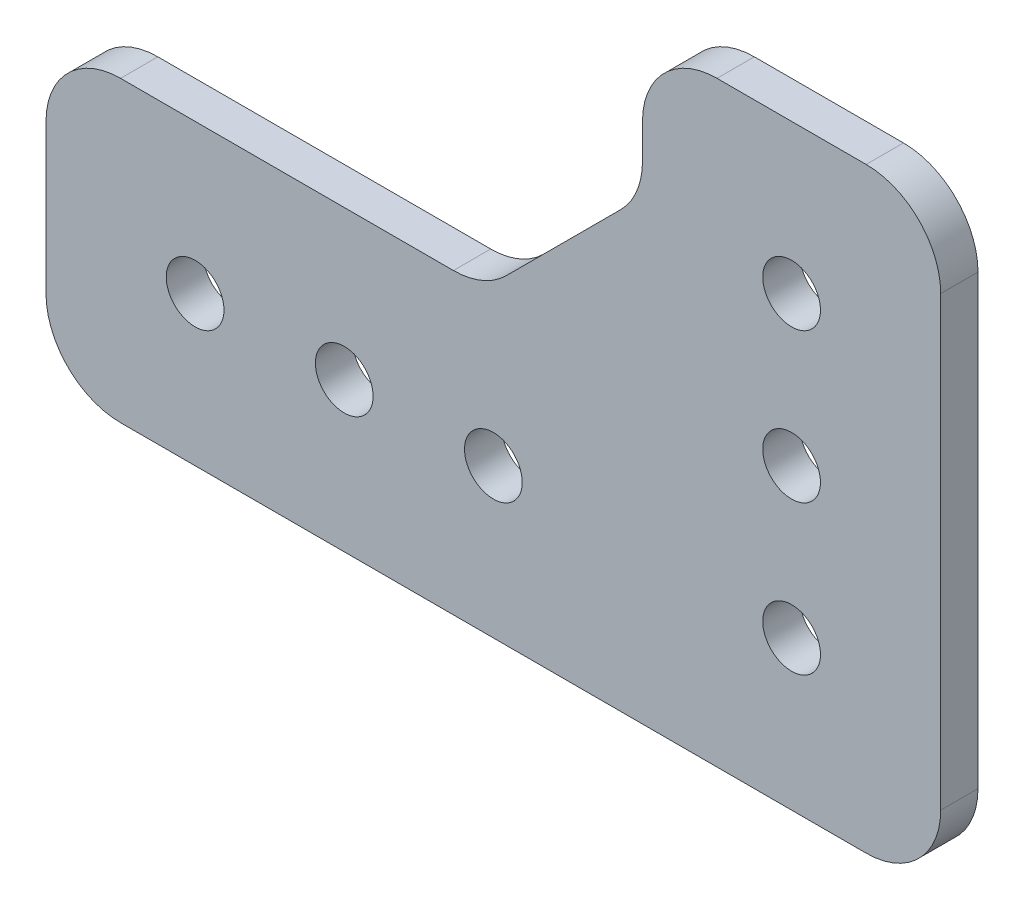
from build123d import *

# Parameters (mm, degrees)
BOSS_EXTRUDE1_DEPTH          = 3.175
FILLET1_R                    = 6.35
F_10_0_1935_DIAMETER_HOLE1_D = 4.9149


with BuildPart() as part:
    # Sketch1 → Boss-Extrude1 (new body)
    with BuildSketch(Plane.XY):
        Polygon((0, 0), (0, 50.8), (-25.4, 50.8), (-25.4, 38.870384182), (-38.870384182, 25.4), (-76.2, 25.4), (-76.2, 0), align=None)
    extrude(amount=BOSS_EXTRUDE1_DEPTH)

    # Fillet1
    fillet1_edges = [part.edges().sort_by_distance(p)[0] for p in [
        (-76.2, 0, 1.5875),
        (-76.2, 25.4, 1.5875),
        (-38.870384182, 25.4, 1.5875),
        (-25.4, 38.870384182, 1.5875),
        (-25.4, 50.8, 1.5875),
        (0, 50.8, 1.5875),
        (0, 0, 1.5875),
    ]]
    fillet(fillet1_edges, radius=FILLET1_R)

    # #10 (0.1935) Diameter Hole1 (through all)
    with Locations(Plane.XY.offset(3.175)):
        with Locations((-63.5, 12.7), (-50.8, 12.7), (-12.7, 25.4), (-12.7, 38.1), (-38.1, 12.7), (-12.7, 12.7)):
            Hole(F_10_0_1935_DIAMETER_HOLE1_D / 2)


solid = part.part
